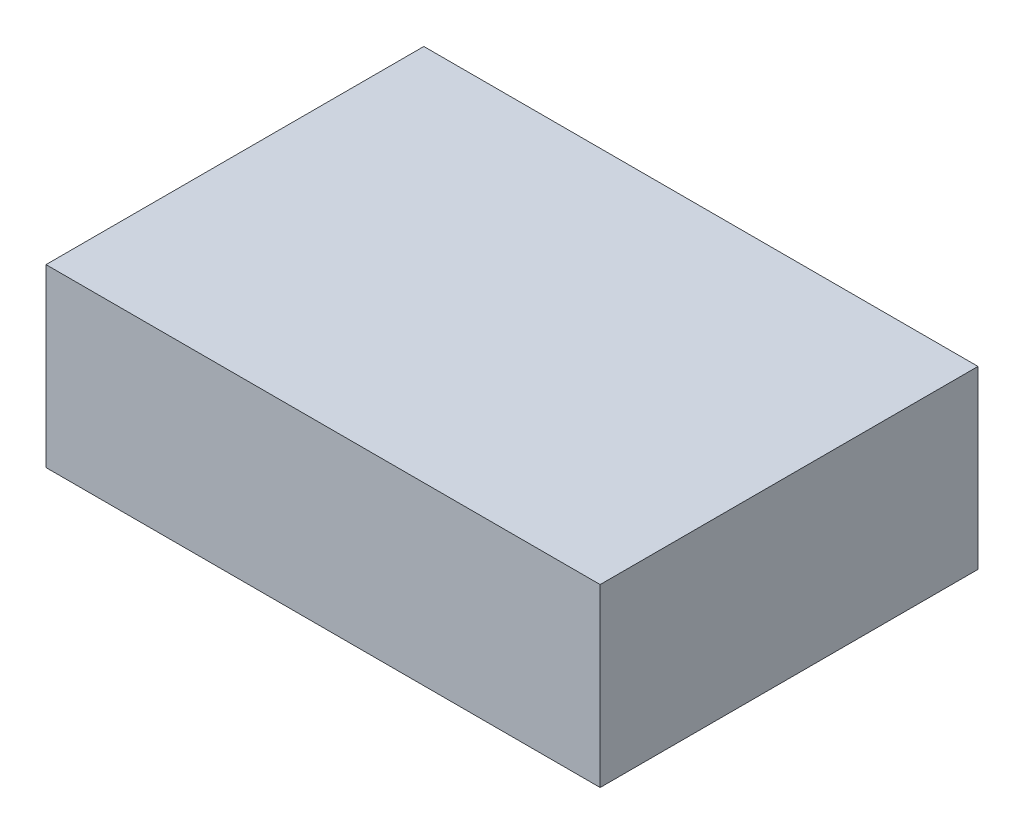
from build123d import *

# Parameters (mm, degrees)
SKETCH_1_W      = 31.523645178
SKETCH_1_H      = 21.493394439
EXTRUDE_1_DEPTH = 10


with BuildPart() as part:
    # Эскиз1 → Бобышка-Вытянуть1 (new body)
    with BuildSketch(Plane(origin=(0, 0, 0), x_dir=(1, 0, 0), z_dir=(0, 1, 0))):
        with Locations((15.761822589, 10.74669722)):
            Rectangle(SKETCH_1_W, SKETCH_1_H)
    extrude(amount=EXTRUDE_1_DEPTH)


solid = part.part
